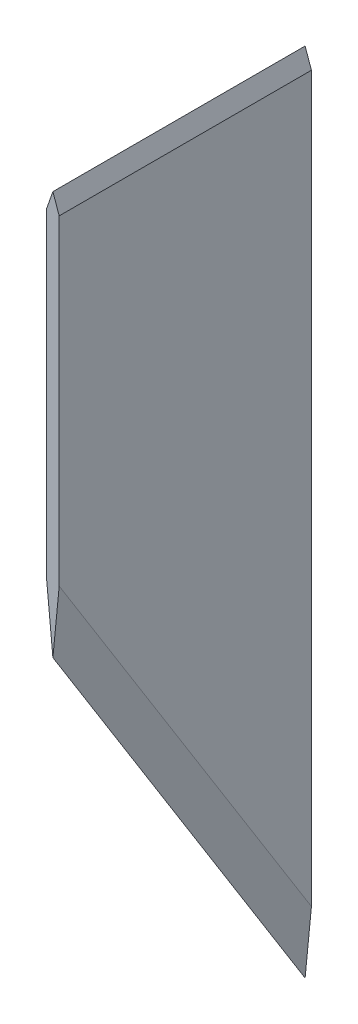
from build123d import *

# Parameters (mm, degrees)
BOSS_EXTRUDE1_DEPTH     = 3.175
CUT_EXTRUDE1_DEPTH      = 120.85362166
CUT_EXTRUDE1_DEPTH_BACK = 120.85362166
CUT_EXTRUDE2_DEPTH      = 213.914467862
CUT_EXTRUDE2_DEPTH_BACK = 213.914467862


with BuildPart() as part:
    # Sketch1 → Boss-Extrude1 (new body)
    with BuildSketch(Plane.YZ):
        Polygon((0, 0), (203.2, 0), (203.2, 63.5), (101.6, 63.5), align=None)
    extrude(amount=BOSS_EXTRUDE1_DEPTH)

    # Sketch2 → Cut-Extrude1 (cut, two sides: drawn at the far end of the back side and taken through both)
    with BuildSketch(Plane(origin=(0, 101.6, 63.5), x_dir=(-1, 0, 0), z_dir=(0, 0.8479983040050879, 0.52999894000318)).offset(-CUT_EXTRUDE1_DEPTH_BACK)):
        Polygon((-3.175, -8.683746968), (-3.175, 1.50596977), (0, 1.50596977), (0, -8.683746968), (-1.5875, 0), align=None)
    extrude(amount=CUT_EXTRUDE1_DEPTH + CUT_EXTRUDE1_DEPTH_BACK, mode=Mode.SUBTRACT)

    # Sketch3 → Cut-Extrude2 (cut, two sides: drawn at the far end of the back side and taken through both)
    with BuildSketch(Plane.XY.offset(63.5).offset(-CUT_EXTRUDE2_DEPTH_BACK)):
        Polygon((0, 198.707072367), (1.5875, 203.2), (3.175, 198.707072367), (3.175, 209.769975366), (0, 209.769975366), align=None)
    extrude(amount=CUT_EXTRUDE2_DEPTH + CUT_EXTRUDE2_DEPTH_BACK, mode=Mode.SUBTRACT)


solid = part.part
